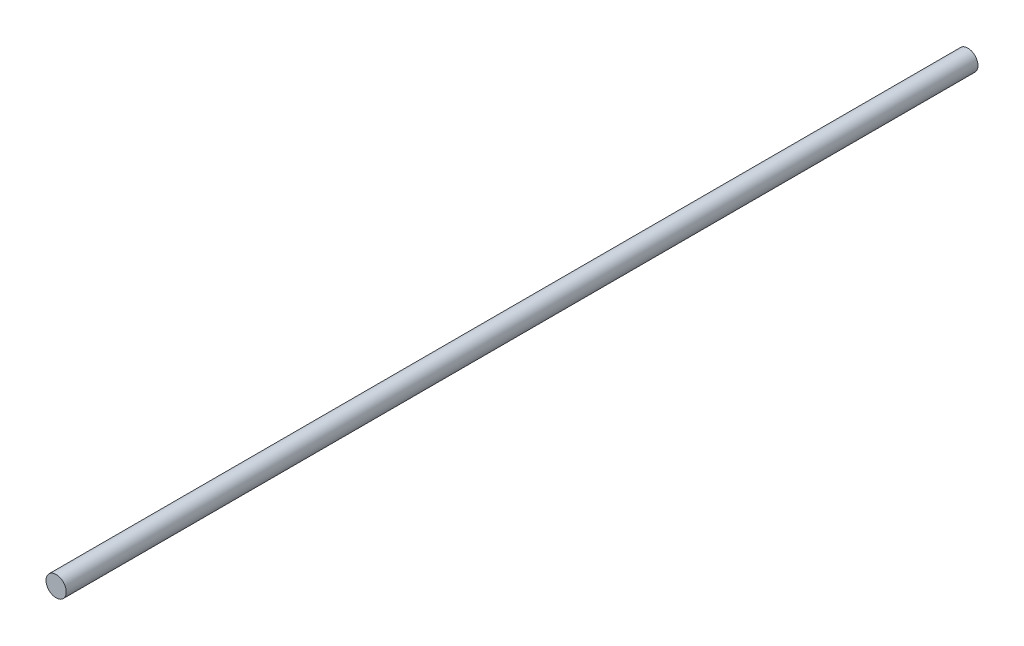
from build123d import *

# Parameters (mm, degrees)
SKETCH1_R           = 5
BOSS_EXTRUDE1_DEPTH = 450


with BuildPart() as part:
    # Sketch1 → Boss-Extrude1 (new body)
    with BuildSketch(Plane.XY):
        Circle(SKETCH1_R)
    extrude(amount=BOSS_EXTRUDE1_DEPTH)


solid = part.part
